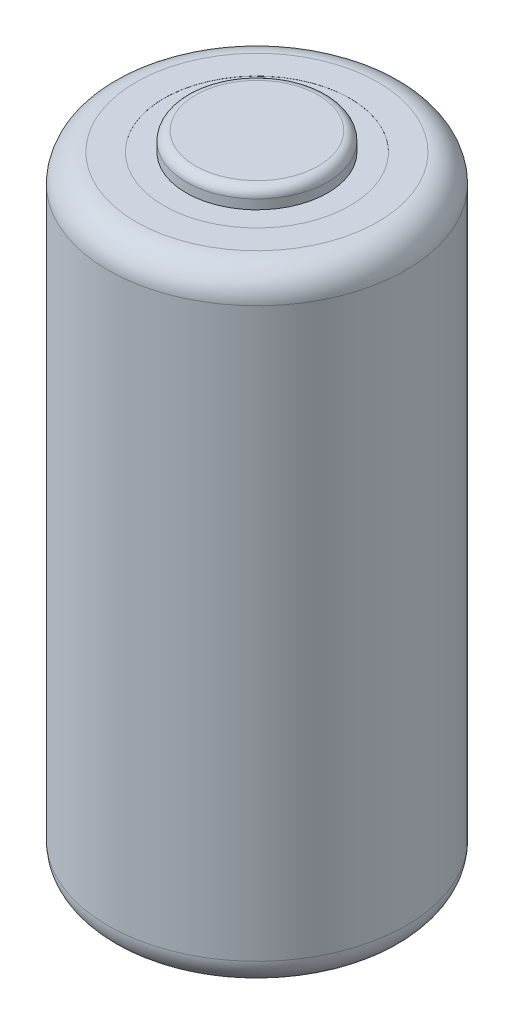
from build123d import *

# Parameters (mm, degrees)
SKIZZE1_R                       = 8
AUFSATZ_LINEAR_AUSTRAGEN1_DEPTH = 33.5
SKIZZE2_R                       = 3.799988553
AUFSATZ_LINEAR_AUSTRAGEN2_DEPTH = 1
VERRUNDUNG1_R                   = 1.5
VERRUNDUNG2_R                   = 0.5
SCHNITT_LINEAR_START            = -0.005
SKIZZE3_R                       = 5
SKIZZE3_R_2                     = 3.799988553
SCHNITT_LINEAR_AUSTRAGEN1_DEPTH = 0.005


with BuildPart() as part:
    # Skizze1 → Aufsatz-Linear austragen1 (new body)
    with BuildSketch(Plane(origin=(0, 0, 0), x_dir=(1, 0, 0), z_dir=(0, 1, 0))):
        with Locations(Location((0, 0, 0), (0, 0, 270))):
            Circle(SKIZZE1_R)
    extrude(amount=AUFSATZ_LINEAR_AUSTRAGEN1_DEPTH)

    # Skizze2 → Aufsatz-Linear austragen2 (add)
    with BuildSketch(Plane(origin=(0, 33.5, 0), x_dir=(1, 0, 0), z_dir=(0, 1, 0))):
        with Locations(Location((0, 0, 0), (0, 0, 270))):
            Circle(SKIZZE2_R)
    extrude(amount=AUFSATZ_LINEAR_AUSTRAGEN2_DEPTH)

    # Verrundung1
    verrundung1_edges = [part.edges().sort_by_distance(p)[0] for p in [
        (0, 0, -8),
        (0, 33.5, -8),
    ]]
    fillet(verrundung1_edges, radius=VERRUNDUNG1_R)

    # Verrundung2
    verrundung2_edges = [part.edges().sort_by_distance(p)[0] for p in [
        (0, 34.5, -3.799988553),
    ]]
    fillet(verrundung2_edges, radius=VERRUNDUNG2_R)

    # Skizze3 → Schnitt-Linear austragen1 (cut)
    with BuildSketch(Plane(origin=(0, 33.5, 0), x_dir=(1, 0, 0), z_dir=(0, 1, 0)).offset(SCHNITT_LINEAR_START)):
        with Locations(Location((0, 0, 0), (0, 0, 270))):
            Circle(SKIZZE3_R)
        with Locations(Location((0, 0, 0), (0, 0, 270))):
            Circle(SKIZZE3_R_2, mode=Mode.SUBTRACT)
    extrude(amount=SCHNITT_LINEAR_AUSTRAGEN1_DEPTH, mode=Mode.SUBTRACT)


solid = part.part
